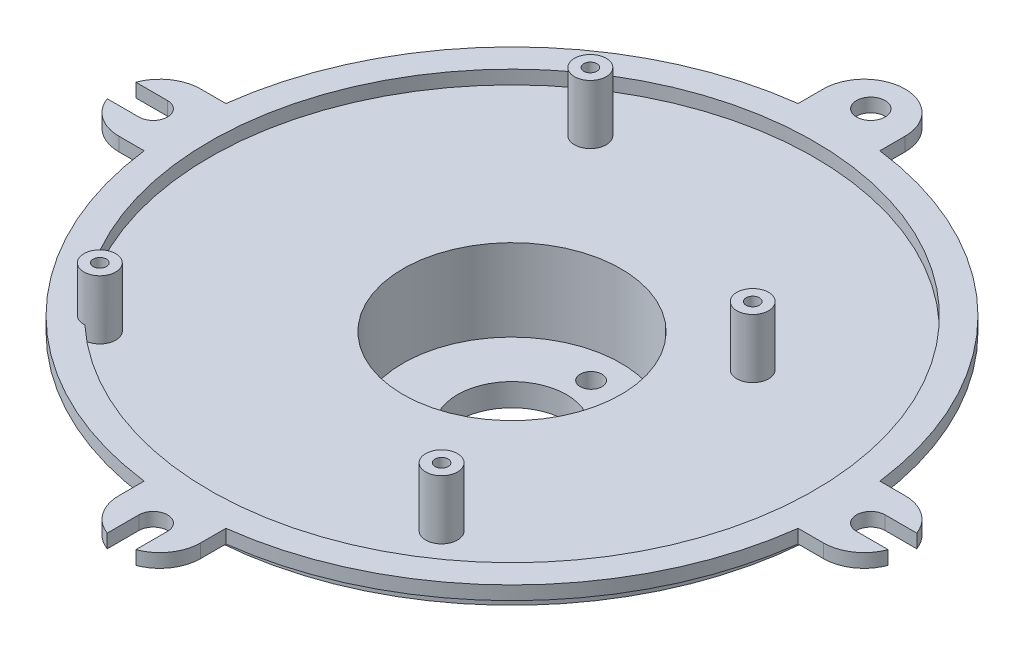
from build123d import *

# Parameters (mm, degrees)
SKETCH1_R           = 69.55
BOSS_EXTRUDE1_DEPTH = 3
SKETCH2_R           = 72.55
SKETCH2_R_2         = 66.55
BOSS_EXTRUDE2_DEPTH = 3
SKETCH4_R           = 3.5
SKETCH4_R_2         = 1.45
BOSS_EXTRUDE3_DEPTH = 13
SKETCH5_R           = 3.15
BOSS_EXTRUDE4_DEPTH = 3
CIRPATTERN1_COUNT   = 4
SKETCH6_R           = 27.5
BOSS_EXTRUDE5_DEPTH = 20
SKETCH7_R           = 12
CUT_EXTRUDE1_DEPTH  = 128.58450141
SKETCH8_R           = 24
CUT_EXTRUDE2_DEPTH  = 18
SKETCH9_R           = 2.4
CUT_EXTRUDE3_DEPTH  = 127.264820912
SKETCH10_W          = 19.93582071
SKETCH10_H          = 6.3
SKETCH10_W_2        = 6.3
SKETCH10_H_2        = 19.93582071
CUT_EXTRUDE4_DEPTH  = 126.131151197


with BuildPart() as part:
    # Sketch1 → Boss-Extrude1 (new body)
    with BuildSketch(Plane(origin=(0, 0, 0), x_dir=(1, 0, 0), z_dir=(0, 1, 0))):
        with Locations(Location((0, 0, 0), (0, 0, 270))):
            Circle(SKETCH1_R)
    extrude(amount=BOSS_EXTRUDE1_DEPTH)

    # Sketch2 → Boss-Extrude2 (add)
    with BuildSketch(Plane(origin=(0, 3, 0), x_dir=(1, 0, 0), z_dir=(0, 1, 0))):
        with Locations(Location((0, 0, 0), (0, 0, 270))):
            Circle(SKETCH2_R)
        with Locations(Location((0, 0, 0), (0, 0, 270))):
            Circle(SKETCH2_R_2, mode=Mode.SUBTRACT)
    extrude(amount=BOSS_EXTRUDE2_DEPTH)

    # Sketch4 → Boss-Extrude3 (add)
    # profile 1 of 4: a face of its own
    with BuildSketch(Plane(origin=(0, 3, 0), x_dir=(1, 0, 0), z_dir=(0, 1, 0))):
        with Locations(Location((-28.75, 46, 0), (0, 0, 270))):
            Circle(SKETCH4_R)
        with Locations(Location((-28.75, 46, 0), (0, 0, 270))):
            Circle(SKETCH4_R_2, mode=Mode.SUBTRACT)
    # profile 2 of 4: a face of its own
    with BuildSketch(Plane(origin=(0, 3, 0), x_dir=(1, 0, 0), z_dir=(0, 1, 0))):
        with Locations(Location((33.75, 19.25, 0), (0, 0, 270))):
            Circle(SKETCH4_R)
        with Locations(Location((33.75, 19.25, 0), (0, 0, 270))):
            Circle(SKETCH4_R_2, mode=Mode.SUBTRACT)
    # profile 3 of 4: a face of its own
    with BuildSketch(Plane(origin=(0, 3, 0), x_dir=(1, 0, 0), z_dir=(0, 1, 0))):
        with Locations(Location((30.25, -45.75, 0), (0, 0, 270))):
            Circle(SKETCH4_R)
        with Locations(Location((30.25, -45.75, 0), (0, 0, 270))):
            Circle(SKETCH4_R_2, mode=Mode.SUBTRACT)
    # profile 4 of 4: a face of its own
    with BuildSketch(Plane(origin=(0, 3, 0), x_dir=(1, 0, 0), z_dir=(0, 1, 0))):
        with Locations(Location((-45.5, -45.25, 0), (0, 0, 176.546315789))):
            Circle(SKETCH4_R)
        with Locations(Location((-45.5, -45.25, 0), (0, 0, 270))):
            Circle(SKETCH4_R_2, mode=Mode.SUBTRACT)
    extrude(amount=BOSS_EXTRUDE3_DEPTH)

    # Sketch5 → Boss-Extrude4 (add)
    with BuildSketch(Plane(origin=(0, 3, 0), x_dir=(1, 0, 0), z_dir=(0, 1, 0))):
        with BuildLine():
            Line((-9, -69.55), (9, -69.55))
            Line((9, -69.55), (9, -77.55))
            ThreePointArc((9, -77.55), (0, -86.55), (-9, -77.55))
            Line((-9, -77.55), (-9, -69.55))
        make_face()
        with Locations(Location((0, -79, 0), (0, 0, 270))):
            Circle(SKETCH5_R, mode=Mode.SUBTRACT)
    boss_extrude4 = extrude(amount=BOSS_EXTRUDE4_DEPTH)

    # CirPattern1: Boss-Extrude4 ×4 about axis
    cirpattern1_axis = Axis((0, 0, 0), (0, 1, 0))
    for i in range(1, CIRPATTERN1_COUNT):
        add(boss_extrude4.rotate(cirpattern1_axis, i * 360 / CIRPATTERN1_COUNT))

    # Sketch6 → Boss-Extrude5 (add)
    with BuildSketch(Plane.XZ):
        with Locations(Location((0, 0, 0), (0, 0, 270))):
            Circle(SKETCH6_R)
    extrude(amount=BOSS_EXTRUDE5_DEPTH)

    # Sketch7 → Cut-Extrude1 (cut, through all)
    with BuildSketch(Plane.XZ.offset(20)):
        with Locations(Location((0, 0, 0), (0, 0, 270))):
            Circle(SKETCH7_R)
    extrude(amount=-CUT_EXTRUDE1_DEPTH, mode=Mode.SUBTRACT)

    # Sketch8 → Cut-Extrude2 (cut)
    with BuildSketch(Plane(origin=(0, 3, 0), x_dir=(1, 0, 0), z_dir=(0, 1, 0))):
        with Locations(Location((0, 0, 0), (0, 0, 270))):
            Circle(SKETCH8_R)
    extrude(amount=-CUT_EXTRUDE2_DEPTH, mode=Mode.SUBTRACT)

    # Sketch9 → Cut-Extrude3 (cut, through all)
    with BuildSketch(Plane(origin=(0, -15, 0), x_dir=(1, 0, 0), z_dir=(0, 1, 0))):
        with Locations(Location((0, 17.41, 0), (0, 0, 270))):
            Circle(SKETCH9_R)
        with Locations(Location((-15.07750228, -8.705, 0), (0, 0, 270))):
            Circle(SKETCH9_R)
        with Locations(Location((15.07750228, -8.705, 0), (0, 0, 270))):
            Circle(SKETCH9_R)
    extrude(amount=-CUT_EXTRUDE3_DEPTH, mode=Mode.SUBTRACT)

    # Sketch10 → Cut-Extrude4 (cut, through all)
    with BuildSketch(Plane(origin=(0, 6, 0), x_dir=(1, 0, 0), z_dir=(0, 1, 0))):
        with Locations((-88.967910355, 0)):
            Rectangle(SKETCH10_W, SKETCH10_H)
        with Locations((0, -88.967910355)):
            Rectangle(SKETCH10_W_2, SKETCH10_H_2)
        with Locations((88.967910355, 0)):
            Rectangle(SKETCH10_W, SKETCH10_H)
    extrude(amount=-CUT_EXTRUDE4_DEPTH, mode=Mode.SUBTRACT)

    # Sketch11 → Revolve1 (revolve)
    with BuildSketch(Plane(origin=(0, 0, 0), x_dir=(0, 0, -1), z_dir=(1, 0, 0))):
        with BuildLine():
            Line((27.5, 0), (27.5, -5))
            ThreePointArc((27.5, -5), (31.035533906, -3.535533906), (32.5, 0))
            Line((32.5, 0), (27.5, 0))
        make_face()
    revolve(axis=Axis((0, -20, 0), (0, 1, 0)))


solid = part.part
